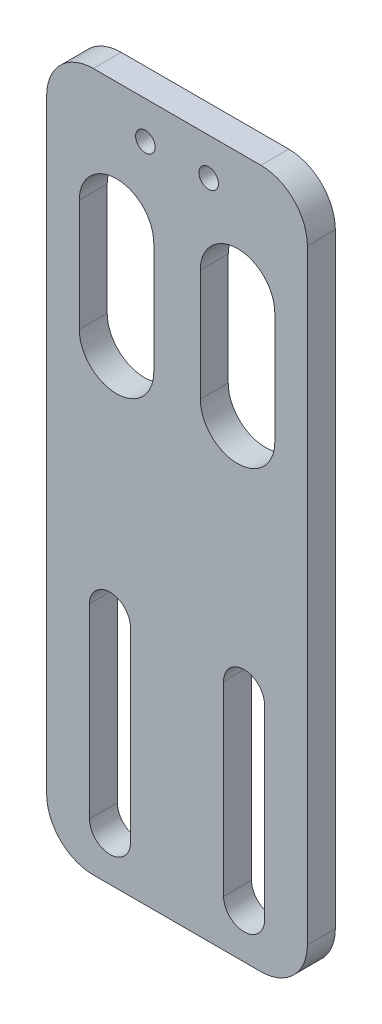
from build123d import *

# Parameters (mm, degrees)
SKETCH1_W           = 28
SKETCH1_H           = 75
BOSS_EXTRUDE1_DEPTH = 3
SKETCH2_R           = 1.05
CUT_EXTRUDE1_DEPTH  = 41.140378673
FILLET1_R           = 5


with BuildPart() as part:
    # Sketch1 → Boss-Extrude1 (new body)
    with BuildSketch(Plane.XY):
        Rectangle(SKETCH1_W, SKETCH1_H)
    extrude(amount=BOSS_EXTRUDE1_DEPTH)

    # Sketch2 → Cut-Extrude1 (cut, through all)
    with BuildSketch(Plane.XY.offset(3)):
        with Locations((-3.4, 33.5)):
            Circle(SKETCH2_R)
        with Locations((3.4, 33.5)):
            Circle(SKETCH2_R)
        with BuildLine():
            Line((-10.499999957, 12.5), (-10.499999957, 24.5))
            ThreePointArc((-10.499999957, 24.5), (-6.5, 28.499999957), (-2.500000043, 24.5))
            Line((-2.500000043, 24.5), (-2.500000043, 12.5))
            ThreePointArc((-2.500000043, 12.5), (-6.5, 8.500000043), (-10.499999957, 12.5))
        make_face()
        with BuildLine():
            Line((2.500000043, 12.5), (2.500000043, 24.5))
            ThreePointArc((2.500000043, 24.5), (6.5, 28.499999957), (10.499999957, 24.5))
            Line((10.499999957, 24.5), (10.499999957, 12.5))
            ThreePointArc((10.499999957, 12.5), (6.5, 8.500000043), (2.500000043, 12.5))
        make_face()
        with BuildLine():
            Line((-9.4, -32.5), (-9.4, -12.5))
            ThreePointArc((-9.4, -12.5), (-7.2, -10.3), (-5, -12.5))
            Line((-5, -12.5), (-5, -32.5))
            ThreePointArc((-5, -32.5), (-7.2, -34.7), (-9.4, -32.5))
        make_face()
        with BuildLine():
            Line((5, -32.5), (5, -12.5))
            ThreePointArc((5, -12.5), (7.2, -10.3), (9.4, -12.5))
            Line((9.4, -12.5), (9.4, -32.5))
            ThreePointArc((9.4, -32.5), (7.2, -34.7), (5, -32.5))
        make_face()
    extrude(amount=-CUT_EXTRUDE1_DEPTH, mode=Mode.SUBTRACT)

    # Fillet1
    fillet1_edges = [part.edges().sort_by_distance(p)[0] for p in [
        (-14, 37.5, 1.5),
        (14, 37.5, 1.5),
        (14, -37.5, 1.5),
        (-14, -37.5, 1.5),
    ]]
    fillet(fillet1_edges, radius=FILLET1_R)


solid = part.part
